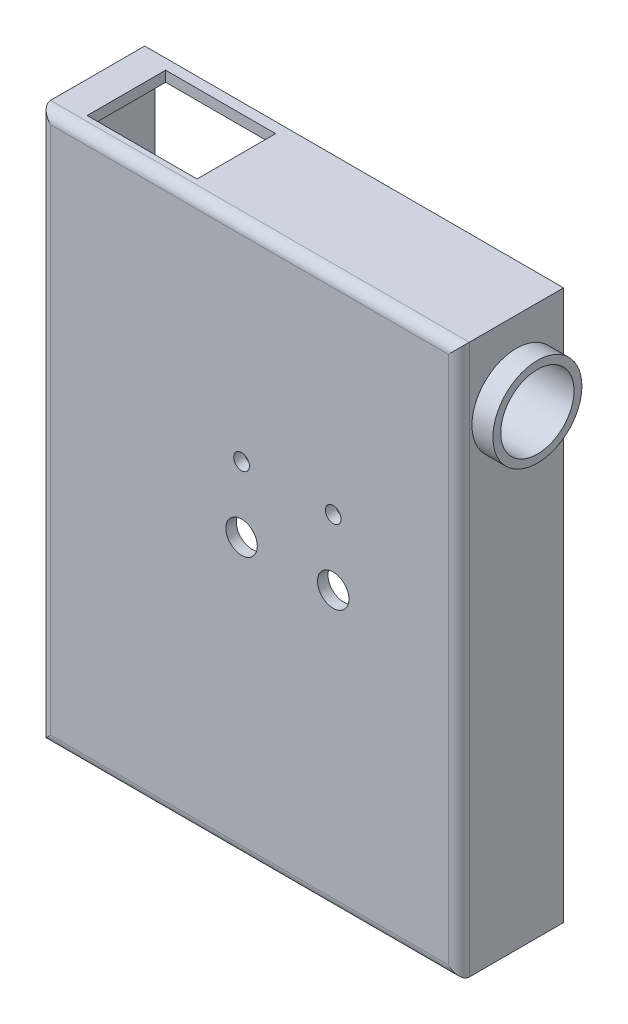
from build123d import *

# Parameters (mm, degrees)
SKETCH1_W                     = 80
SKETCH1_H                     = 105
BOSS_EXTRUDE1_DEPTH           = 20
CUT_EXTRUDE4_DEPTH            = 20
CUT_EXTRUDE4_DEPTH_BACK       = 20
SKETCH1_3_R                   = 3
SKETCH1_3_R_2                 = 1.5
SKETCH2_W                     = 76
SKETCH2_H                     = 101
CUT_EXTRUDE5_DEPTH            = 18
SKETCH3_R                     = 6.5
CUT_EXTRUDE6_DEPTH            = 18
SKETCH5_R                     = 8.5
BOSS_EXTRUDE2_DEPTH           = 4
BOSS_EXTRUDE3_START           = 4
SKETCH6_R                     = 8.5
BOSS_EXTRUDE3_DEPTH           = 4
SKETCH7_R                     = 7
CUT_EXTRUDE7_DEPTH            = 24
SKETCH8_W                     = 30
SKETCH8_H                     = 1.5
BOSS_EXTRUDE4_DEPTH           = 14
SKETCH9_R                     = 2.5
CUT_EXTRUDE8_DEPTH            = 14
SKETCH10_W                    = 21
SKETCH10_H                    = 15
CUT_EXTRUDE9_DEPTH            = 14
FILLET1_R                     = 2
SKETCH11_R                    = 3
BOSS_EXTRUDE5_DEPTH           = 20
TAP_DRILL_FOR_4_40_TAP2_D     = 2.2606
TAP_DRILL_FOR_4_40_TAP2_DEPTH = 13.05
TAP_DRILL_FOR_4_40_TAP2_TIP   = 0.679152758


with BuildPart() as part:
    # Sketch1 → Boss-Extrude1 (new body)
    with BuildSketch(Plane.XY):
        with Locations((1071.513868959, -1418.75124805)):
            Rectangle(SKETCH1_W, SKETCH1_H)
    extrude(amount=BOSS_EXTRUDE1_DEPTH)

    # Sketch1<3> → Cut-Extrude4 (cut, two sides: drawn at the far end of the back side and taken through both)
    with BuildSketch(Plane.XY.offset(-CUT_EXTRUDE4_DEPTH_BACK)):
        with Locations((1087.513868959, -1418.25124805)):
            Circle(SKETCH1_3_R)
        with Locations((1070.013868959, -1418.25124805)):
            Circle(SKETCH1_3_R)
        with Locations((1087.513868959, -1405.75124805)):
            Circle(SKETCH1_3_R_2)
        with Locations((1070.013868959, -1405.75124805)):
            Circle(SKETCH1_3_R_2)
    extrude(amount=CUT_EXTRUDE4_DEPTH + CUT_EXTRUDE4_DEPTH_BACK, mode=Mode.SUBTRACT)

    # Sketch2 → Cut-Extrude5 (cut)
    with BuildSketch(Plane(origin=(0, 0, 0), x_dir=(-1, 0, 0), z_dir=(0, 0, -1))):
        with Locations((-1071.513868959, -1418.75124805)):
            Rectangle(SKETCH2_W, SKETCH2_H)
    extrude(amount=-CUT_EXTRUDE5_DEPTH, mode=Mode.SUBTRACT)

    # Sketch3 → Cut-Extrude6 (cut)
    with BuildSketch(Plane.ZY.offset(-1109.513868959)):
        with Locations((9, -1380.25124805)):
            Circle(SKETCH3_R)
    extrude(amount=-CUT_EXTRUDE6_DEPTH, mode=Mode.SUBTRACT)

    # Sketch5 → Boss-Extrude2 (add)
    with BuildSketch(Plane(origin=(1111.513868959, 0, 0), x_dir=(0, 0, -1), z_dir=(1, 0, 0))):
        with Locations((-9, -1380.25124805)):
            Circle(SKETCH5_R)
    extrude(amount=BOSS_EXTRUDE2_DEPTH)

    # Sketch6 → Boss-Extrude3 (add)
    with BuildSketch(Plane.ZY.offset(-1109.513868959).offset(BOSS_EXTRUDE3_START)):
        with Locations((9, -1380.25124805)):
            Circle(SKETCH6_R)
    extrude(amount=-BOSS_EXTRUDE3_DEPTH)

    # Sketch7 → Cut-Extrude7 (cut)
    with BuildSketch(Plane(origin=(1115.513868959, 0, 0), x_dir=(0, 0, -1), z_dir=(1, 0, 0))):
        with Locations((-9, -1380.25124805)):
            Circle(SKETCH7_R)
    extrude(amount=-CUT_EXTRUDE7_DEPTH, mode=Mode.SUBTRACT)

    # Sketch8 → Boss-Extrude4 (add)
    with BuildSketch(Plane(origin=(0, 0, 18), x_dir=(-1, 0, 0), z_dir=(0, 0, -1))):
        with Locations((-1087.013868959, -1389.00124805)):
            Rectangle(SKETCH8_W, SKETCH8_H)
    extrude(amount=BOSS_EXTRUDE4_DEPTH)

    # Sketch9 → Cut-Extrude8 (cut)
    with BuildSketch(Plane(origin=(0, -1469.25124805, 0), x_dir=(1, 0, 0), z_dir=(0, 1, 0))):
        with Locations((1071.513868959, 0)):
            Circle(SKETCH9_R)
    extrude(amount=-CUT_EXTRUDE8_DEPTH, mode=Mode.SUBTRACT)

    # Sketch10 → Cut-Extrude9 (cut)
    with BuildSketch(Plane(origin=(0, -1366.25124805, 0), x_dir=(1, 0, 0), z_dir=(0, 1, 0))):
        with Locations((1048.013868959, -9.5)):
            Rectangle(SKETCH10_W, SKETCH10_H)
    extrude(amount=-CUT_EXTRUDE9_DEPTH, mode=Mode.SUBTRACT)

    # Fillet1
    fillet1_edges = [part.edges().sort_by_distance(p)[0] for p in [
        (1031.513868959, -1418.75124805, 20),
        (1071.513868959, -1471.25124805, 20),
        (1111.513868959, -1418.75124805, 20),
        (1071.513868959, -1366.25124805, 20),
    ]]
    fillet(fillet1_edges, radius=FILLET1_R)

    # Sketch11 → Boss-Extrude5 (add)
    with BuildSketch(Plane(origin=(0, 0, 18), x_dir=(-1, 0, 0), z_dir=(0, 0, -1))):
        with Locations((-1039.513868959, -1419.25124805)):
            Circle(SKETCH11_R)
    extrude(amount=BOSS_EXTRUDE5_DEPTH)

    # Tap Drill for #4-40 Tap2
    with Locations(Plane(origin=(0, 0, -2), x_dir=(-1, 0, 0), z_dir=(0, 0, -1))):
        with Locations((-1039.426320133, -1419.282531473)):
            Hole(TAP_DRILL_FOR_4_40_TAP2_D / 2, depth=TAP_DRILL_FOR_4_40_TAP2_DEPTH)
            with Locations((0, 0, -(TAP_DRILL_FOR_4_40_TAP2_DEPTH + TAP_DRILL_FOR_4_40_TAP2_TIP / 2))):  # 118° drill point
                Cone(0, TAP_DRILL_FOR_4_40_TAP2_D / 2, TAP_DRILL_FOR_4_40_TAP2_TIP, mode=Mode.SUBTRACT)


solid = part.part
